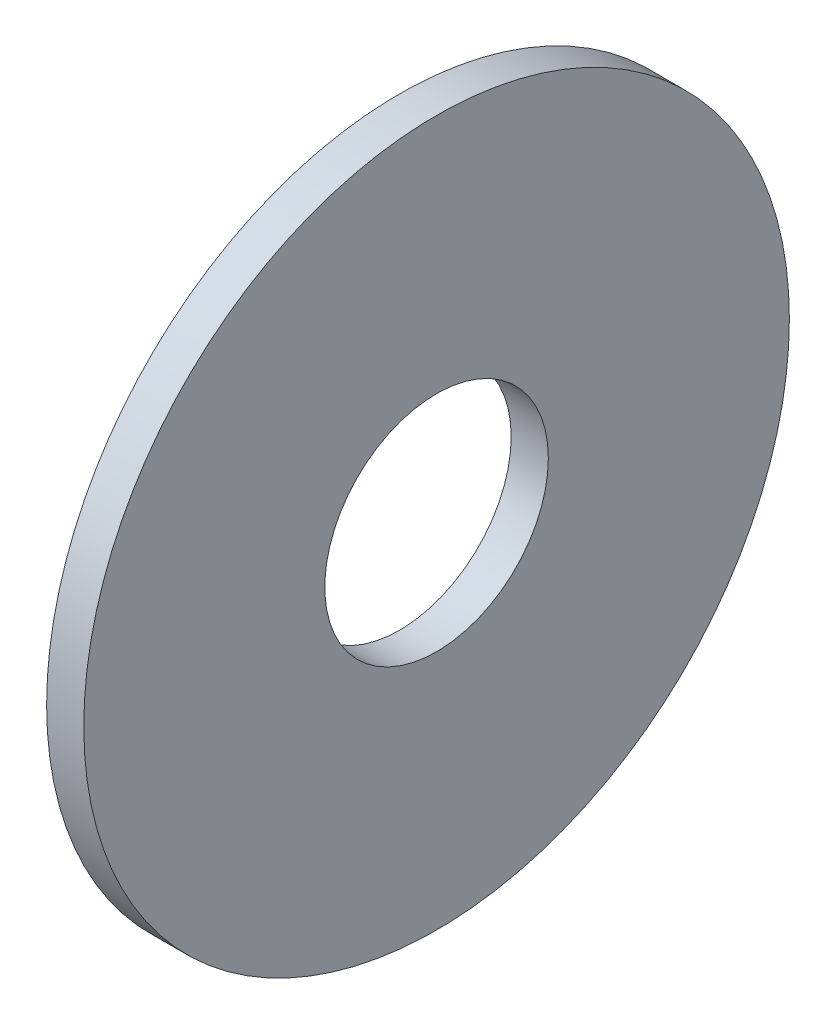
from build123d import *

# Parameters (mm, degrees)
BOSS_EXTRUDE1_DEPTH      = 0.5
BOSS_EXTRUDE1_DEPTH_BACK = 0.5
SKETCH3_R                = 9.5
SKETCH3_R_2              = 3.01


with BuildPart() as part:
    # Sketch3 → Boss-Extrude1 (new, two sides: drawn at the far end of the back side and taken through both)
    with BuildSketch(Plane(origin=(0, 0, 0), x_dir=(0, 0, -1), z_dir=(1, 0, 0)).offset(-BOSS_EXTRUDE1_DEPTH_BACK)):
        Circle(SKETCH3_R)
        Circle(SKETCH3_R_2, mode=Mode.SUBTRACT)
    extrude(amount=BOSS_EXTRUDE1_DEPTH + BOSS_EXTRUDE1_DEPTH_BACK)


solid = part.part
